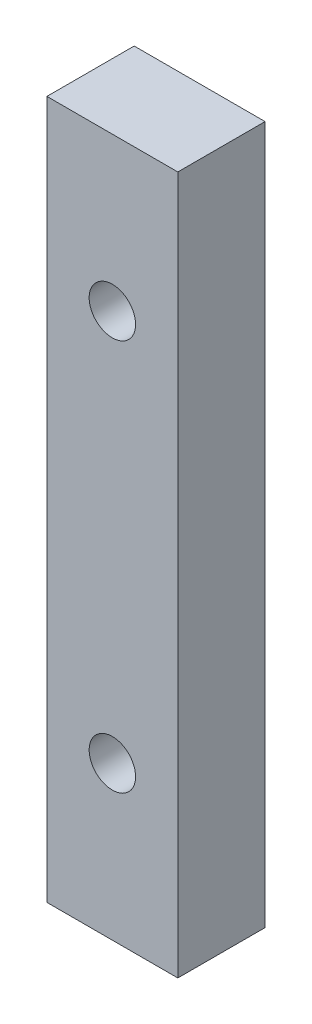
from build123d import *

# Parameters (mm, degrees)
SKETCH1_W               = 19.05
SKETCH1_H               = 101.6
BOSS_EXTRUDE1_DEPTH     = 12.7
F_1_4_CLEARANCE_HOLE1_D = 6.7564


with BuildPart() as part:
    # Sketch1 → Boss-Extrude1 (new body)
    with BuildSketch(Plane.XY):
        Rectangle(SKETCH1_W, SKETCH1_H)
    extrude(amount=BOSS_EXTRUDE1_DEPTH)

    # 1/4 Clearance Hole1 (through all)
    with Locations(Plane.XY.offset(12.7)):
        with Locations((0, 28.5), (0, -28.5)):
            Hole(F_1_4_CLEARANCE_HOLE1_D / 2)


solid = part.part
